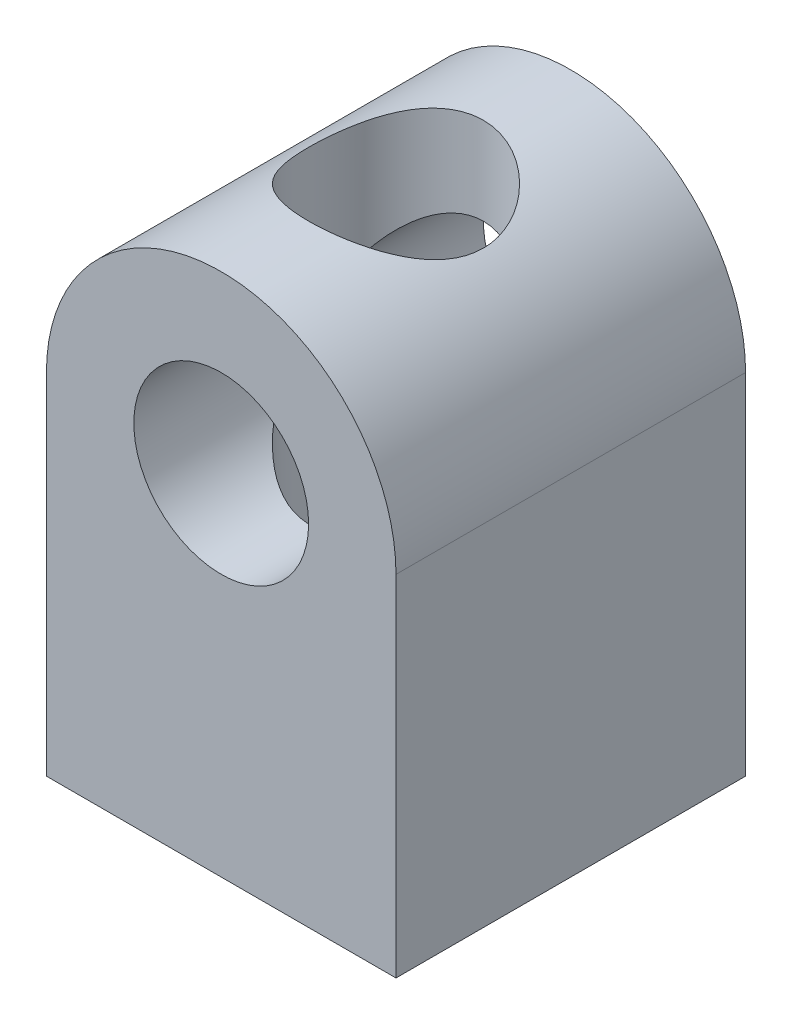
from build123d import *

# Parameters (mm, degrees)
SKETCH1_R           = 2.5
SKETCH1_R_2         = 1.25
BOSS_EXTRUDE1_DEPTH = 5
SKETCH2_R           = 1.25
CUT_EXTRUDE1_DEPTH  = 10.354143467


with BuildPart() as part:
    # Sketch1 → Boss-Extrude1 (new body)
    # profile 1 of 2: a face of its own
    with BuildSketch(Plane.XY):
        with BuildLine():
            ThreePointArc((2.5, 0), (0, -2.5), (-2.5, 0))
            Line((-2.5, 0), (-2.5, -5))
            Line((-2.5, -5), (2.5, -5))
            Line((2.5, -5), (2.5, 0))
        make_face()
    # profile 2 of 2: a face of its own
    with BuildSketch(Plane.XY):
        Circle(SKETCH1_R)
        Circle(SKETCH1_R_2, mode=Mode.SUBTRACT)
    extrude(amount=BOSS_EXTRUDE1_DEPTH)

    # Sketch2 → Cut-Extrude1 (cut, through all)
    with BuildSketch(Plane.XZ.offset(5)):
        with Locations(Location((0, 2.5, 0), (0, 0, 270))):
            Circle(SKETCH2_R)
    extrude(amount=-CUT_EXTRUDE1_DEPTH, mode=Mode.SUBTRACT)


solid = part.part
